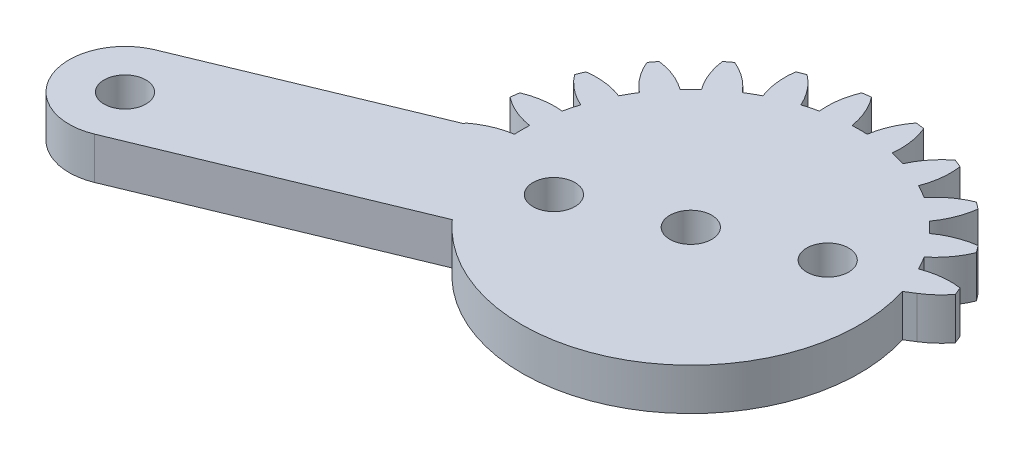
from build123d import *

# Parameters (mm, degrees)
SKETCH1_R           = 1.500000006
SKETCH1_R_2         = 1.5
BOSS_EXTRUDE1_DEPTH = 1.5


with BuildPart() as part:
    # Sketch1 → Boss-Extrude1 (new, symmetric)
    with BuildSketch(Plane(origin=(0, 0, 0), x_dir=(1, 0, 0), z_dir=(0, 1, 0))):
        with BuildLine():
            Line((-9.06493699, -8.135610408), (-27.161854519, -15.631599086))
            ThreePointArc((-27.161854519, -15.631599086), (-32.388091388, -13.466808476), (-30.223321978, -8.240562826))
            Line((-30.223321978, -8.240562826), (-14.579602701, -1.760722136))
            ThreePointArc((-14.579602701, -1.760722136), (-14.584687893, -1.716362865), (-14.589637633, -1.671988275))
            ThreePointArc((-14.589637633, -1.671988275), (-13.427690306, -0.989315431), (-12.132887918, -0.615616914))
            ThreePointArc((-12.132887918, -0.615616914), (-12.145072741, -0.072894557), (-12.132887919, 0.469827801))
            ThreePointArc((-12.132887919, 0.469827801), (-13.427690307, 0.843526317), (-14.589637634, 1.526199162))
            ThreePointArc((-14.589637634, 1.526199162), (-14.55220384, 1.836051004), (-14.508166551, 2.14503348))
            ThreePointArc((-14.508166551, 2.14503348), (-13.209122885, 2.503710713), (-11.861719526, 2.529556244))
            ThreePointArc((-11.861719526, 2.529556244), (-11.733022279, 3.05693945), (-11.580785762, 3.578015328))
            ThreePointArc((-11.580785762, 3.578015328), (-12.734748535, 4.274099894), (-13.680414734, 5.234245323))
            ThreePointArc((-13.680414734, 5.234245323), (-13.564060907, 5.523850641), (-13.441553603, 5.810907105))
            ThreePointArc((-13.441553603, 5.810907105), (-12.093941278, 5.821145467), (-10.785760259, 5.497376682))
            ThreePointArc((-10.785760259, 5.497376682), (-10.524951446, 5.973480443), (-10.243037902, 6.437399381))
            ThreePointArc((-10.243037902, 6.437399381), (-11.177520404, 7.408432983), (-11.842459886, 8.580618673))
            ThreePointArc((-11.842459886, 8.580618673), (-11.655115347, 8.830241342), (-11.462486699, 9.075809372))
            ThreePointArc((-11.462486699, 9.075809372), (-10.158143266, 8.736911135), (-8.978334963, 8.085592341))
            ThreePointArc((-8.978334963, 8.085592341), (-8.603188274, 8.477970972), (-8.210809644, 8.853117661))
            ThreePointArc((-8.210809644, 8.853117661), (-8.862128438, 10.032925965), (-9.201026675, 11.337269397))
            ThreePointArc((-9.201026675, 11.337269397), (-8.955458646, 11.529898046), (-8.705835976, 11.717242585))
            ThreePointArc((-8.705835976, 11.717242585), (-7.533650287, 11.052303103), (-6.562616684, 10.117820601))
            ThreePointArc((-6.562616684, 10.117820601), (-6.098697746, 10.399734146), (-5.622593986, 10.66054296))
            ThreePointArc((-5.622593986, 10.66054296), (-5.946362771, 11.968723978), (-5.936124409, 13.316336304))
            ThreePointArc((-5.936124409, 13.316336304), (-5.649067945, 13.438843608), (-5.359462627, 13.555197435))
            ThreePointArc((-5.359462627, 13.555197435), (-4.399317198, 12.609531237), (-3.703232632, 11.455568464))
            ThreePointArc((-3.703232632, 11.455568464), (-3.182156754, 11.607804981), (-2.654773548, 11.736502229))
            ThreePointArc((-2.654773548, 11.736502229), (-2.628928016, 13.083905587), (-2.270250783, 14.382949252))
            ThreePointArc((-2.270250783, 14.382949252), (-1.961268307, 14.426986541), (-1.651416464, 14.464420335))
            ThreePointArc((-1.651416464, 14.464420335), (-0.96874362, 13.302473008), (-0.595045103, 12.007670621))
            ThreePointArc((-0.595045103, 12.007670621), (-0.052322745, 12.019855443), (0.490399612, 12.00767062))
            ThreePointArc((0.490399612, 12.00767062), (0.864098129, 13.302473008), (1.546770973, 14.464420336))
            ThreePointArc((1.546770973, 14.464420336), (1.856622816, 14.426986541), (2.165605292, 14.382949252))
            ThreePointArc((2.165605292, 14.382949252), (2.524282525, 13.083905586), (2.550128056, 11.736502227))
            ThreePointArc((2.550128056, 11.736502227), (3.077511262, 11.607804979), (3.59858714, 11.455568461))
            ThreePointArc((3.59858714, 11.455568461), (4.294671706, 12.609531235), (5.254817135, 13.555197433))
            ThreePointArc((5.254817135, 13.555197433), (5.544422453, 13.438843606), (5.831478917, 13.316336302))
            ThreePointArc((5.831478917, 13.316336302), (5.841717279, 11.968723977), (5.517948494, 10.660542958))
            ThreePointArc((5.517948494, 10.660542958), (5.994052255, 10.399734145), (6.457971192, 10.117820599))
            ThreePointArc((6.457971192, 10.117820599), (7.429004795, 11.052303102), (8.601190484, 11.717242583))
            ThreePointArc((8.601190484, 11.717242583), (8.850813154, 11.529898045), (9.096381183, 11.337269396))
            ThreePointArc((9.096381183, 11.337269396), (8.757482946, 10.032925964), (8.106164153, 8.85311766))
            ThreePointArc((8.106164153, 8.85311766), (8.498542783, 8.477970971), (8.873689471, 8.085592341))
            ThreePointArc((8.873689471, 8.085592341), (10.053497775, 8.736911134), (11.357841208, 9.075809372))
            ThreePointArc((11.357841208, 9.075809372), (11.550469856, 8.830241342), (11.737814395, 8.580618672))
            ThreePointArc((11.737814395, 8.580618672), (11.072874914, 7.408432983), (10.138392412, 6.437399381))
            ThreePointArc((10.138392412, 6.437399381), (10.420305956, 5.973480443), (10.681114769, 5.497376682))
            ThreePointArc((10.681114769, 5.497376682), (11.989295788, 5.821145468), (13.336908114, 5.810907106))
            ThreePointArc((13.336908114, 5.810907106), (13.459415418, 5.523850641), (13.575769244, 5.234245323))
            ThreePointArc((13.575769244, 5.234245323), (12.915048144, 4.515307178), (12.13566175, 3.927105445))
            Line((12.13566175, 3.927105445), (11.492100034, 3.52723119))
            ThreePointArc((11.492100034, 3.52723119), (5.914919678, -10.59081356), (-9.06493699, -8.135610408))
        make_face()
        with Locations(Location((-0.052322747, -0.072894541, 0), (0, 0, 270))):
            Circle(SKETCH1_R, mode=Mode.SUBTRACT)
        with Locations(Location((-28.692588249, -11.936080956, 0), (0, 0, 270))):
            Circle(SKETCH1_R_2, mode=Mode.SUBTRACT)
        with Locations(Location((-6.981419235, -2.943020296, 0), (0, 0, 270))):
            Circle(SKETCH1_R_2, mode=Mode.SUBTRACT)
        with Locations(Location((6.876773753, 2.79723119, 0), (0, 0, 270))):
            Circle(SKETCH1_R_2, mode=Mode.SUBTRACT)
    extrude(amount=BOSS_EXTRUDE1_DEPTH, both=True)


solid = part.part
